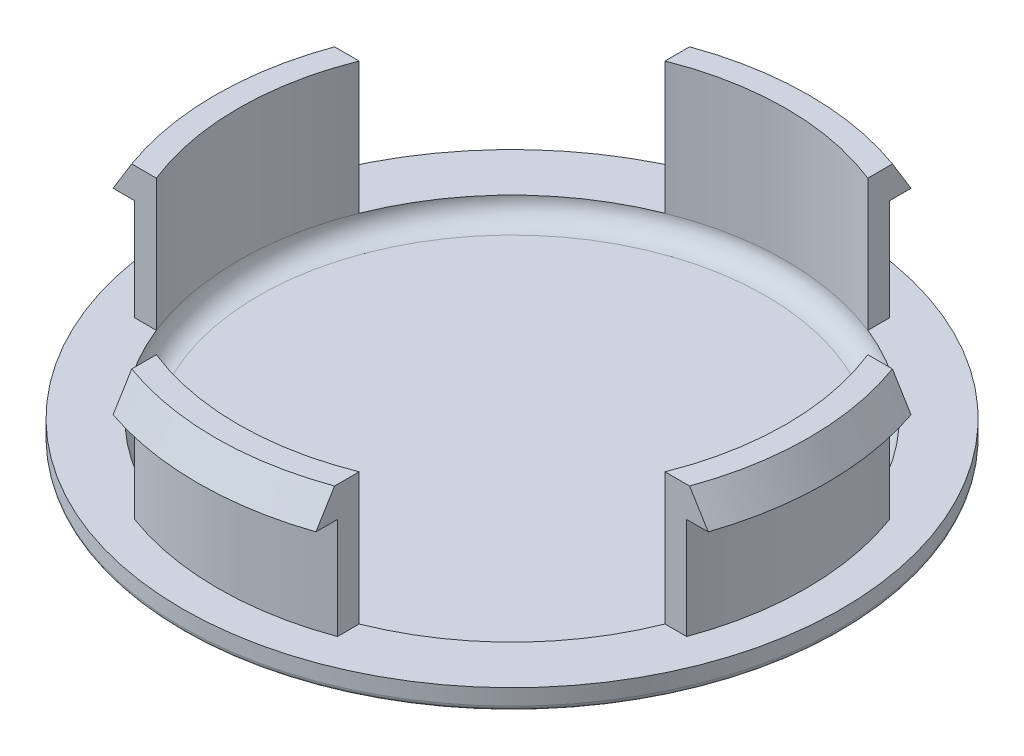
from build123d import *

# Parameters (mm, degrees)
CUT_EXTRUDE_1_REACH         = 51.184
EXTRUDE_4_REACH             = 51.181
EXTRUDE_4_END_MAJOR_RADIUS  = 1.731376058
EXTRUDE_4_END_MINOR_RADIUS  = 190
EXTRUDE_4_DIRECTION_2_DEPTH = 5


with BuildPart() as part:
    # Эскиз1 → Повернуть1 (revolve)
    with BuildSketch(Plane.XY, mode=Mode.PRIVATE) as revolve_1_sk:
        with BuildLine():
            Line((-32.5, 2.92511682), (-32.5, 4.5))
            Line((-32.5, 4.5), (-29, 4.5))
            Line((-29, 4.5), (-29, 14.5))
            Line((-29, 14.5), (-31, 14.5))
            Line((-31, 14.5), (-29.267949192, 17.5))
            Line((-29.267949192, 17.5), (-27, 17.5))
            Line((-27, 17.5), (-27, 4.5))
            ThreePointArc((-27, 4.5), (-26.414213562, 3.085786438), (-25, 2.5))
            Line((-25, 2.5), (0, 2.5))
            Line((0, 2.5), (0, 0))
            ThreePointArc((0, 0), (-16.091489977, 0.535553885), (-32.079864443, 2.43153636))
            ThreePointArc((-32.079864443, 2.43153636), (-32.380744154, 2.601027497), (-32.5, 2.92511682))
        make_face()
    revolve(revolve_1_sk.sketch.rotate(Axis((0, 0, 0), (0, -1, 0)), 270), axis=Axis((0, 0, 0), (0, -1, 0)))

    # Вырез-Вытянуть1: up to this face of the body (flat: up to its plane)
    cut_extrude_1_end = Plane(part.part.faces().sort_by_distance((0, 4.5, -31.580761184))[0])
    # Эскиз2 → Вырез-Вытянуть1 (cut, up to the picked face)
    with BuildSketch(Plane(origin=(0, 17.5, 0), x_dir=(1, 0, 0), z_dir=(0, 1, 0)), mode=Mode.PRIVATE) as cut_extrude_1_sk1:
        with BuildLine():
            Line((-10, 27.50659648), (-10, 40.856644609))
            ThreePointArc((-10, 40.856644609), (-29.742775667, 29.742775667), (-40.856644609, 10))
            Line((-40.856644609, 10), (-27.50659648, 10))
            ThreePointArc((-27.50659648, 10), (-20.695565345, 20.695565345), (-10, 27.50659648))
        make_face()
    cut_extrude_1_tool1 = split(extrude(cut_extrude_1_sk1.sketch, amount=-CUT_EXTRUDE_1_REACH, mode=Mode.PRIVATE), bisect_by=cut_extrude_1_end, keep=Keep.BOTH, mode=Mode.PRIVATE)
    # Эскиз2 → Вырез-Вытянуть1 (cut, up to the picked face)
    with BuildSketch(Plane(origin=(0, 17.5, 0), x_dir=(1, 0, 0), z_dir=(0, 1, 0)), mode=Mode.PRIVATE) as cut_extrude_1_sk2:
        with BuildLine():
            ThreePointArc((27.50659648, 10), (20.695565345, 20.695565345), (10, 27.50659648))
            Line((10, 27.50659648), (10, 25.079872408))
            ThreePointArc((10, 25.079872408), (19.091883092, 19.091883092), (25.079872408, 10))
            Line((25.079872408, 10), (27.50659648, 10))
        make_face()
    cut_extrude_1_tool2 = split(extrude(cut_extrude_1_sk2.sketch, amount=-CUT_EXTRUDE_1_REACH, mode=Mode.PRIVATE), bisect_by=cut_extrude_1_end, keep=Keep.BOTH, mode=Mode.PRIVATE)
    # Эскиз2 → Вырез-Вытянуть1 (cut, up to the picked face)
    with BuildSketch(Plane(origin=(0, 17.5, 0), x_dir=(1, 0, 0), z_dir=(0, 1, 0)), mode=Mode.PRIVATE) as cut_extrude_1_sk3:
        with BuildLine():
            ThreePointArc((40.856644609, 10), (29.742775667, 29.742775667), (10, 40.856644609))
            Line((10, 40.856644609), (10, 27.50659648))
            ThreePointArc((10, 27.50659648), (20.695565345, 20.695565345), (27.50659648, 10))
            Line((27.50659648, 10), (40.856644609, 10))
        make_face()
    cut_extrude_1_tool3 = split(extrude(cut_extrude_1_sk3.sketch, amount=-CUT_EXTRUDE_1_REACH, mode=Mode.PRIVATE), bisect_by=cut_extrude_1_end, keep=Keep.BOTH, mode=Mode.PRIVATE)
    # Эскиз2 → Вырез-Вытянуть1 (cut, up to the picked face)
    with BuildSketch(Plane(origin=(0, 17.5, 0), x_dir=(1, 0, 0), z_dir=(0, 1, 0)), mode=Mode.PRIVATE) as cut_extrude_1_sk4:
        with BuildLine():
            ThreePointArc((10, -40.856644609), (29.742775667, -29.742775667), (40.856644609, -10))
            Line((40.856644609, -10), (27.50659648, -10))
            ThreePointArc((27.50659648, -10), (20.695565345, -20.695565345), (10, -27.50659648))
            Line((10, -27.50659648), (10, -40.856644609))
        make_face()
    cut_extrude_1_tool4 = split(extrude(cut_extrude_1_sk4.sketch, amount=-CUT_EXTRUDE_1_REACH, mode=Mode.PRIVATE), bisect_by=cut_extrude_1_end, keep=Keep.BOTH, mode=Mode.PRIVATE)
    # Эскиз2 → Вырез-Вытянуть1 (cut, up to the picked face)
    with BuildSketch(Plane(origin=(0, 17.5, 0), x_dir=(1, 0, 0), z_dir=(0, 1, 0)), mode=Mode.PRIVATE) as cut_extrude_1_sk5:
        with BuildLine():
            ThreePointArc((10, -27.50659648), (20.695565345, -20.695565345), (27.50659648, -10))
            Line((27.50659648, -10), (25.079872408, -10))
            ThreePointArc((25.079872408, -10), (19.091883092, -19.091883092), (10, -25.079872408))
            Line((10, -25.079872408), (10, -27.50659648))
        make_face()
    cut_extrude_1_tool5 = split(extrude(cut_extrude_1_sk5.sketch, amount=-CUT_EXTRUDE_1_REACH, mode=Mode.PRIVATE), bisect_by=cut_extrude_1_end, keep=Keep.BOTH, mode=Mode.PRIVATE)
    # Эскиз2 → Вырез-Вытянуть1 (cut, up to the picked face)
    with BuildSketch(Plane(origin=(0, 17.5, 0), x_dir=(1, 0, 0), z_dir=(0, 1, 0)), mode=Mode.PRIVATE) as cut_extrude_1_sk6:
        with BuildLine():
            Line((-27.50659648, -10), (-40.856644609, -10))
            ThreePointArc((-40.856644609, -10), (-29.742775667, -29.742775667), (-10, -40.856644609))
            Line((-10, -40.856644609), (-10, -27.50659648))
            ThreePointArc((-10, -27.50659648), (-20.695565345, -20.695565345), (-27.50659648, -10))
        make_face()
    cut_extrude_1_tool6 = split(extrude(cut_extrude_1_sk6.sketch, amount=-CUT_EXTRUDE_1_REACH, mode=Mode.PRIVATE), bisect_by=cut_extrude_1_end, keep=Keep.BOTH, mode=Mode.PRIVATE)
    # Эскиз2 → Вырез-Вытянуть1 (cut, up to the picked face)
    with BuildSketch(Plane(origin=(0, 17.5, 0), x_dir=(1, 0, 0), z_dir=(0, 1, 0)), mode=Mode.PRIVATE) as cut_extrude_1_sk7:
        with BuildLine():
            Line((-25.079872408, -10), (-27.50659648, -10))
            ThreePointArc((-27.50659648, -10), (-20.695565345, -20.695565345), (-10, -27.50659648))
            Line((-10, -27.50659648), (-10, -25.079872408))
            ThreePointArc((-10, -25.079872408), (-19.091883092, -19.091883092), (-25.079872408, -10))
        make_face()
    cut_extrude_1_tool7 = split(extrude(cut_extrude_1_sk7.sketch, amount=-CUT_EXTRUDE_1_REACH, mode=Mode.PRIVATE), bisect_by=cut_extrude_1_end, keep=Keep.BOTH, mode=Mode.PRIVATE)
    # Эскиз2 → Вырез-Вытянуть1 (cut, up to the picked face)
    with BuildSketch(Plane(origin=(0, 17.5, 0), x_dir=(1, 0, 0), z_dir=(0, 1, 0)), mode=Mode.PRIVATE) as cut_extrude_1_sk8:
        with BuildLine():
            Line((-10, 25.079872408), (-10, 27.50659648))
            ThreePointArc((-10, 27.50659648), (-20.695565345, 20.695565345), (-27.50659648, 10))
            Line((-27.50659648, 10), (-25.079872408, 10))
            ThreePointArc((-25.079872408, 10), (-19.091883092, 19.091883092), (-10, 25.079872408))
        make_face()
    cut_extrude_1_tool8 = split(extrude(cut_extrude_1_sk8.sketch, amount=-CUT_EXTRUDE_1_REACH, mode=Mode.PRIVATE), bisect_by=cut_extrude_1_end, keep=Keep.BOTH, mode=Mode.PRIVATE)
    add(cut_extrude_1_tool1.solids().sort_by(Axis((-24.563821, 17.5, -24.563821), (0, -1, 0)))[0], mode=Mode.SUBTRACT)
    add(cut_extrude_1_tool2.solids().sort_by(Axis((19.327069, 17.5, -19.327069), (0, -1, 0)))[0], mode=Mode.SUBTRACT)
    add(cut_extrude_1_tool3.solids().sort_by(Axis((24.563821, 17.5, -24.563821), (0, -1, 0)))[0], mode=Mode.SUBTRACT)
    add(cut_extrude_1_tool4.solids().sort_by(Axis((24.563821, 17.5, 24.563821), (0, -1, 0)))[0], mode=Mode.SUBTRACT)
    add(cut_extrude_1_tool5.solids().sort_by(Axis((19.327069, 17.5, 19.327069), (0, -1, 0)))[0], mode=Mode.SUBTRACT)
    add(cut_extrude_1_tool6.solids().sort_by(Axis((-24.563821, 17.5, 24.563821), (0, -1, 0)))[0], mode=Mode.SUBTRACT)
    add(cut_extrude_1_tool7.solids().sort_by(Axis((-19.327069, 17.5, 19.327069), (0, -1, 0)))[0], mode=Mode.SUBTRACT)
    add(cut_extrude_1_tool8.solids().sort_by(Axis((-19.327069, 17.5, -19.327069), (0, -1, 0)))[0], mode=Mode.SUBTRACT)

    # Бобышка-Вытянуть4: up to this torus (the profile starts outside it)
    extrude_4_end = Plane(origin=(0, 189.992111249, 0), z_dir=(0, 1, 0)) * Torus(EXTRUDE_4_END_MAJOR_RADIUS, EXTRUDE_4_END_MINOR_RADIUS, mode=Mode.PRIVATE)
    # Эскиз3 → Бобышка-Вытянуть4 (add, up to the surface)
    with BuildSketch(Plane(origin=(0, 0, 0), x_dir=(1, 0, 0), z_dir=(0, 1, 0)), mode=Mode.PRIVATE) as extrude_4_sk1:
        Polygon((-13.6, 7.817288532), (-27.1, 0), (-13.6, -7.817288532), (-0.1, 0), align=None)
    extrude_4_tool1 = extrude(extrude_4_sk1.sketch, amount=EXTRUDE_4_REACH, mode=Mode.PRIVATE) - extrude_4_end
    add(extrude_4_tool1.solids().sort_by_distance((-13.6, 0, 0))[0])
    # Эскиз3 → Бобышка-Вытянуть4 (add, up to the surface)
    with BuildSketch(Plane(origin=(0, 0, 0), x_dir=(1, 0, 0), z_dir=(0, 1, 0)), mode=Mode.PRIVATE) as extrude_4_sk2:
        Polygon((13.569970458, 7.869301225), (13.55, 23.469288443), (0.030029542, 15.686589758), (0.05, 0.08660254), align=None)
    extrude_4_tool2 = extrude(extrude_4_sk2.sketch, amount=EXTRUDE_4_REACH, mode=Mode.PRIVATE) - extrude_4_end
    add(extrude_4_tool2.solids().sort_by_distance((6.8, 0, -11.777945))[0])
    # Эскиз3 → Бобышка-Вытянуть4 (add, up to the surface)
    with BuildSketch(Plane(origin=(0, 0, 0), x_dir=(1, 0, 0), z_dir=(0, 1, 0)), mode=Mode.PRIVATE) as extrude_4_sk3:
        Polygon((0.030029542, -15.686589758), (13.55, -23.469288443), (13.569970458, -7.869301225), (0.05, -0.08660254), align=None)
    extrude_4_tool3 = extrude(extrude_4_sk3.sketch, amount=EXTRUDE_4_REACH, mode=Mode.PRIVATE) - extrude_4_end
    add(extrude_4_tool3.solids().sort_by_distance((6.8, 0, 11.777945))[0])

    # Эскиз3 → Бобышка-Вытянуть4 direction 2 (add)
    with BuildSketch(Plane(origin=(0, 0, 0), x_dir=(1, 0, 0), z_dir=(0, 1, 0))):
        Polygon((-13.6, 7.817288532), (-27.1, 0), (-13.6, -7.817288532), (-0.1, 0), align=None)
        Polygon((13.569970458, 7.869301225), (13.55, 23.469288443), (0.030029542, 15.686589758), (0.05, 0.08660254), align=None)
        Polygon((0.030029542, -15.686589758), (13.55, -23.469288443), (13.569970458, -7.869301225), (0.05, -0.08660254), align=None)
    extrude(amount=-EXTRUDE_4_DIRECTION_2_DEPTH)

    # Эскиз4 → Вырез-Повернуть2 (revolve, cut)
    with BuildSketch(Plane.XY):
        with BuildLine():
            Line((0, -18.219550631), (-32.5, -18.219550631))
            Line((-32.5, -18.219550631), (-32.5, 2))
            ThreePointArc((-32.5, 2), (-16.412493716, -1.423565726), (0, -2.5))
            Line((0, -2.5), (0, -18.219550631))
        make_face()
    revolve(axis=Axis((0, 0, 0), (0, -1, 0)), mode=Mode.SUBTRACT)


solid = part.part
